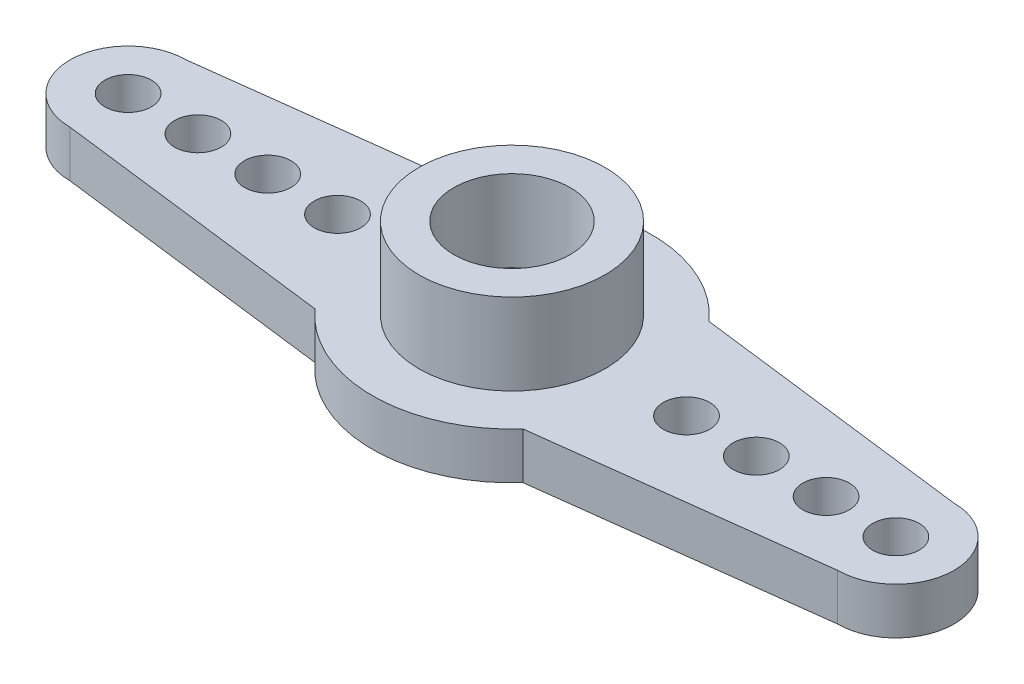
from build123d import *

# Parameters (mm, degrees)
BOSS_EXTRUDE1_DEPTH = 2
SKETCH2_R           = 4
SKETCH2_R_2         = 2.5
BOSS_EXTRUDE2_DEPTH = 3.5
SKETCH3_R           = 1.5
CUT_EXTRUDE1_DEPTH  = 5
SKETCH4_R           = 3
CUT_EXTRUDE2_DEPTH  = 1
SKETCH5_R           = 1
CUT_EXTRUDE3_DEPTH  = 5


with BuildPart() as part:
    # Sketch1 → Boss-Extrude1 (new body)
    with BuildSketch(Plane(origin=(0, 0, 0), x_dir=(1, 0, 0), z_dir=(0, 1, 0))):
        with BuildLine():
            Line((-16.5, 2.5), (-4.472135955, 4))
            ThreePointArc((-4.472135955, 4), (0, 6), (4.472135955, 4))
            Line((4.472135955, 4), (16.5, 2.5))
            ThreePointArc((16.5, 2.5), (19, 0), (16.5, -2.5))
            Line((16.5, -2.5), (4.472135955, -4))
            ThreePointArc((4.472135955, -4), (0, -6), (-4.472135955, -4))
            Line((-4.472135955, -4), (-16.5, -2.5))
            ThreePointArc((-16.5, -2.5), (-19, 0), (-16.5, 2.5))
        make_face()
    extrude(amount=BOSS_EXTRUDE1_DEPTH)

    # Sketch2 → Boss-Extrude2 (add)
    with BuildSketch(Plane(origin=(0, 2, 0), x_dir=(1, 0, 0), z_dir=(0, 1, 0))):
        with Locations(Location((0, 0, 0), (0, 0, 270))):
            Circle(SKETCH2_R)
        with Locations(Location((0, 0, 0), (0, 0, 270))):
            Circle(SKETCH2_R_2, mode=Mode.SUBTRACT)
    extrude(amount=BOSS_EXTRUDE2_DEPTH)

    # Sketch3 → Cut-Extrude1 (cut)
    with BuildSketch(Plane(origin=(0, 2, 0), x_dir=(1, 0, 0), z_dir=(0, 1, 0))):
        with Locations(Location((0, 0, 0), (0, 0, 270))):
            Circle(SKETCH3_R)
    extrude(amount=-CUT_EXTRUDE1_DEPTH, mode=Mode.SUBTRACT)

    # Sketch4 → Cut-Extrude2 (cut)
    with BuildSketch(Plane.XZ):
        with Locations(Location((0, 0, 0), (0, 0, 270))):
            Circle(SKETCH4_R)
    extrude(amount=-CUT_EXTRUDE2_DEPTH, mode=Mode.SUBTRACT)

    # Sketch5 → Cut-Extrude3 (cut)
    with BuildSketch(Plane.XZ):
        with Locations(Location((-16.5, 0, 0), (0, 0, 270))):
            Circle(SKETCH5_R)
        with Locations(Location((-10.5, 0, 0), (0, 0, 270))):
            Circle(SKETCH5_R)
        with Locations(Location((-7.5, 0, 0), (0, 0, 270))):
            Circle(SKETCH5_R)
        with Locations(Location((7.5, 0, 0), (0, 0, 270))):
            Circle(SKETCH5_R)
        with Locations(Location((10.5, 0, 0), (0, 0, 270))):
            Circle(SKETCH5_R)
        with Locations(Location((13.5, 0, 0), (0, 0, 270))):
            Circle(SKETCH5_R)
        with Locations(Location((16.5, 0, 0), (0, 0, 270))):
            Circle(SKETCH5_R)
        with Locations(Location((-13.5, 0, 0), (0, 0, 90))):
            Circle(SKETCH5_R)
    extrude(amount=-CUT_EXTRUDE3_DEPTH, mode=Mode.SUBTRACT)


solid = part.part
